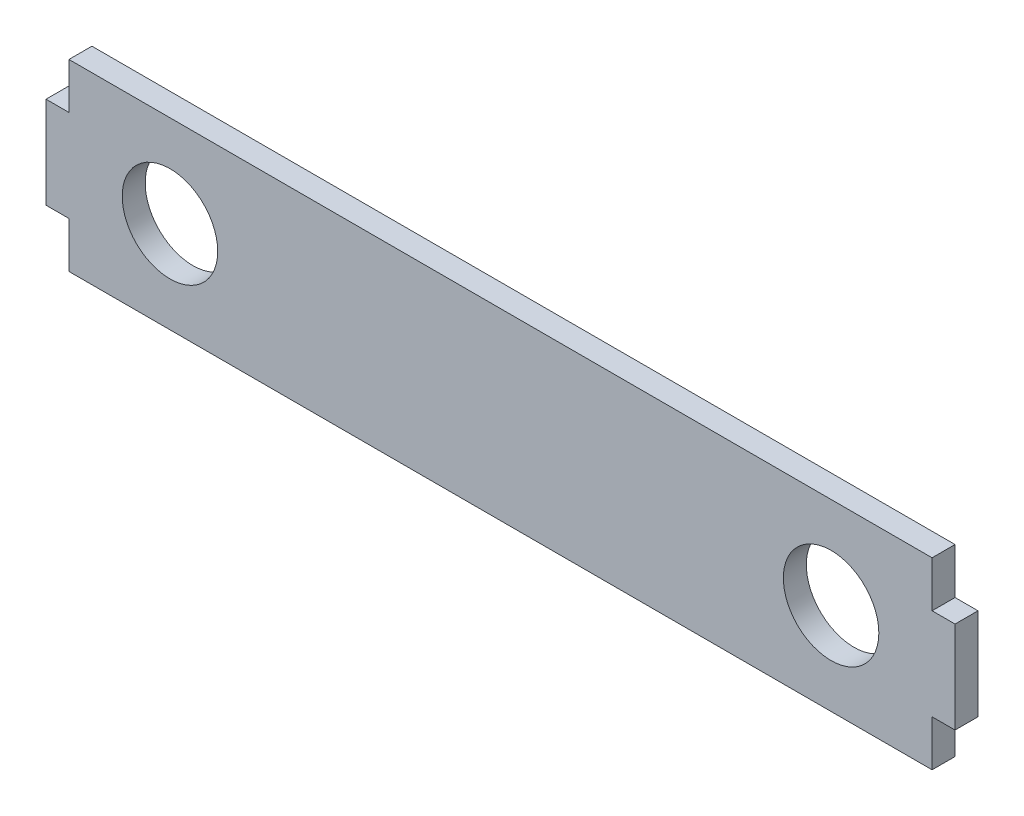
from build123d import *

# Parameters (mm, degrees)
SKETCH1_R           = 3.302
BOSS_EXTRUDE1_DEPTH = 1.5875


with BuildPart() as part:
    # Sketch1 → Boss-Extrude1 (new body)
    with BuildSketch(Plane.XY):
        Polygon((29.845, -3.175), (31.4325, -3.175), (31.4325, 3.175), (29.845, 3.175), (29.845, 6.35), (-29.845, 6.35), (-29.845, 3.175), (-31.4325, 3.175), (-31.4325, -3.175), (-29.845, -3.175), (-29.845, -6.35), (29.845, -6.35), align=None)
        with Locations((-22.86, 0)):
            Circle(SKETCH1_R, mode=Mode.SUBTRACT)
        with Locations((22.86, 0)):
            Circle(SKETCH1_R, mode=Mode.SUBTRACT)
    extrude(amount=-BOSS_EXTRUDE1_DEPTH)


solid = part.part
